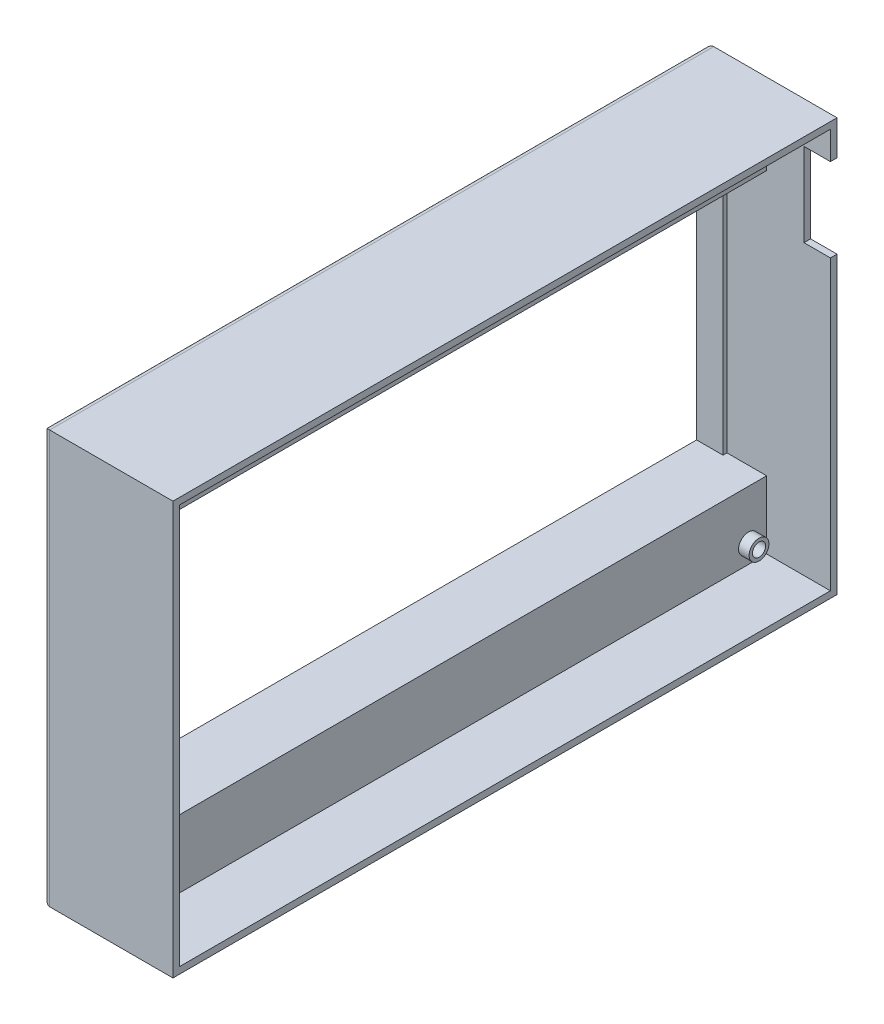
from build123d import *

# Parameters (mm, degrees)
SKETCH1_W            = 92.135626016
SKETCH1_H            = 40
BOSS_EXTRUDE2_DEPTH  = 10
SKETCH2_R            = 1.5
BOSS_EXTRUDE3_DEPTH  = 1.6
SKETCH3_R            = 1
CUT_EXTRUDE1_DEPTH   = 2
SKETCH4_W            = 100.5
SKETCH4_H            = 62.5
SKETCH4_W_2          = 98.5
SKETCH4_H_2          = 60.5
BOSS_EXTRUDE4_DEPTH  = 19.65
SKETCH5_W            = 98
SKETCH5_H            = 40
CUT_EXTRUDE5_DEPTH   = 14.65
SKETCH6_W            = 98.5
SKETCH6_H            = 10.25
BOSS_EXTRUDE5_DEPTH  = 10
SKETCH7_W            = 0.6
SKETCH7_H            = 40.584325063
BOSS_EXTRUDE11_DEPTH = 4
SKETCH8_W            = 0.6
SKETCH8_H            = 40
BOSS_EXTRUDE12_DEPTH = 4
FILLET1_R            = 1
CUT_EXTRUDE6_DEPTH   = 4
SKETCH10_W           = 1
SKETCH10_H           = 2.5
CUT_EXTRUDE8_DEPTH   = 4


with BuildPart() as part:
    # Sketch1 → Boss-Extrude2 (new body)
    with BuildSketch(Plane(origin=(0, 0, 0), x_dir=(0, 0, -1), z_dir=(1, 0, 0))):
        Polygon((-40.481927711, 26.144578313), (-43.416301695, 26.144578313), (-43.416301695, -33.855421687), (-40.481927711, -33.855421687), (54.583698305, -33.855421687), (54.583698305, 26.144578313), (33.734939759, 26.144578313), align=None)
        with Locations((5.585885297, -3.855421687)):
            Rectangle(SKETCH1_W, SKETCH1_H, mode=Mode.SUBTRACT)
    extrude(amount=BOSS_EXTRUDE2_DEPTH)

    # Sketch2 → Boss-Extrude3 (add)
    with BuildSketch(Plane(origin=(10, 0, 0), x_dir=(0, 0, -1), z_dir=(1, 0, 0))):
        with Locations((-40.916301695, 23.644578313)):
            Circle(SKETCH2_R)
        with Locations(Location((52.083698305, 23.644578313, 0), (0, 0, 180))):
            Circle(SKETCH2_R)
        with Locations((52.083698305, -31.355421687)):
            Circle(SKETCH2_R)
        with Locations(Location((-40.916301695, -31.355421687, 0), (0, 0, 180))):
            Circle(SKETCH2_R)
    extrude(amount=BOSS_EXTRUDE3_DEPTH)

    # Sketch3 → Cut-Extrude1 (cut)
    with BuildSketch(Plane(origin=(11.6, 0, 0), x_dir=(0, 0, -1), z_dir=(1, 0, 0))):
        with Locations((-40.916301695, 23.644578313)):
            Circle(SKETCH3_R)
        with Locations((52.083698305, 23.644578313)):
            Circle(SKETCH3_R)
        with Locations((52.083698305, -31.355421687)):
            Circle(SKETCH3_R)
        with Locations((-40.916301695, -31.355421687)):
            Circle(SKETCH3_R)
    extrude(amount=-CUT_EXTRUDE1_DEPTH, mode=Mode.SUBTRACT)

    # Sketch5 → Cut-Extrude5 (cut)
    with BuildSketch(Plane.ZY):
        with Locations((-5.583698305, -3.855421687)):
            Rectangle(SKETCH5_W, SKETCH5_H)
    extrude(amount=-CUT_EXTRUDE5_DEPTH, mode=Mode.SUBTRACT)


with BuildPart() as body_2:
    # Sketch4 → Boss-Extrude4 (new body)
    with BuildSketch(Plane.ZY):
        with Locations((-5.583698305, -3.855421687)):
            Rectangle(SKETCH4_W, SKETCH4_H)
        with Locations((-5.583698305, -3.855421687)):
            Rectangle(SKETCH4_W_2, SKETCH4_H_2, mode=Mode.SUBTRACT)
    extrude(amount=-BOSS_EXTRUDE4_DEPTH)



with BuildPart() as cut_extrude5_piece_1:
    # of the separate pieces the step leaves, piece 1, a body of its own (cut_extrude5_pieces)
    add(part.part.solids().sort_by_distance((0, 26.144578313, -54.583698305))[0])


with BuildPart() as cut_extrude5_piece_2:
    # of the separate pieces the step leaves, piece 2, a body of its own (cut_extrude5_pieces)
    add(part.part.solids().sort_by_distance((0, -23.855421687, 43.416301695))[0])


with BuildPart() as body_2_1:
    add(body_2.part)

    add(cut_extrude5_piece_1.part)  # Boss-Extrude5 merges Cut-Extrude5 piece 1

    add(cut_extrude5_piece_2.part)  # Boss-Extrude5 merges Cut-Extrude5 piece 2
    # Sketch6 → Boss-Extrude5 (add)
    with BuildSketch(Plane.ZY):
        with Locations((-5.583698305, 21.269578313)):
            Rectangle(SKETCH6_W, SKETCH6_H)
        with Locations((-5.583698305, -28.980421687)):
            Rectangle(SKETCH6_W, SKETCH6_H)
    extrude(amount=-BOSS_EXTRUDE5_DEPTH)

    # Sketch7 → Boss-Extrude11 (add)
    with BuildSketch(Plane.ZY):
        with Locations((-54.533698305, -4.147584219)):
            Rectangle(SKETCH7_W, SKETCH7_H)
    extrude(amount=-BOSS_EXTRUDE11_DEPTH)

    # Sketch8 → Boss-Extrude12 (add)
    with BuildSketch(Plane.ZY):
        with Locations((43.366301695, -3.855421687)):
            Rectangle(SKETCH8_W, SKETCH8_H)
    extrude(amount=-BOSS_EXTRUDE12_DEPTH)

    # Fillet1
    fillet1_edges = [body_2_1.edges().sort_by_distance(p)[0] for p in [
        (0, 27.394578313, -5.583698305),
        (0, -3.855421687, 44.666301695),
        (0, -35.105421687, -5.583698305),
        (0, -3.855421687, -55.833698305),
    ]]
    fillet(fillet1_edges, radius=FILLET1_R)

    # Sketch9 → Cut-Extrude6 (cut)
    with BuildSketch(Plane(origin=(19.65, 0, 0), x_dir=(0, 0, -1), z_dir=(1, 0, 0))):
        Polygon((54.833698305, 22.144578313), (47.033698305, 22.144578313), (47.033698305, 12.024578313), (54.833698305, 12.024578313), (55.833698305, 12.024578313), (55.833698305, 22.144578313), align=None)
    extrude(amount=-CUT_EXTRUDE6_DEPTH, mode=Mode.SUBTRACT)

    # Sketch10 → Cut-Extrude8 (cut)
    with BuildSketch(Plane(origin=(19.65, 0, 0), x_dir=(0, 0, -1), z_dir=(1, 0, 0))):
        with Locations((55.333698305, 10.774578313)):
            Rectangle(SKETCH10_W, SKETCH10_H)
    extrude(amount=-CUT_EXTRUDE8_DEPTH, mode=Mode.SUBTRACT)


solid = body_2_1.part
